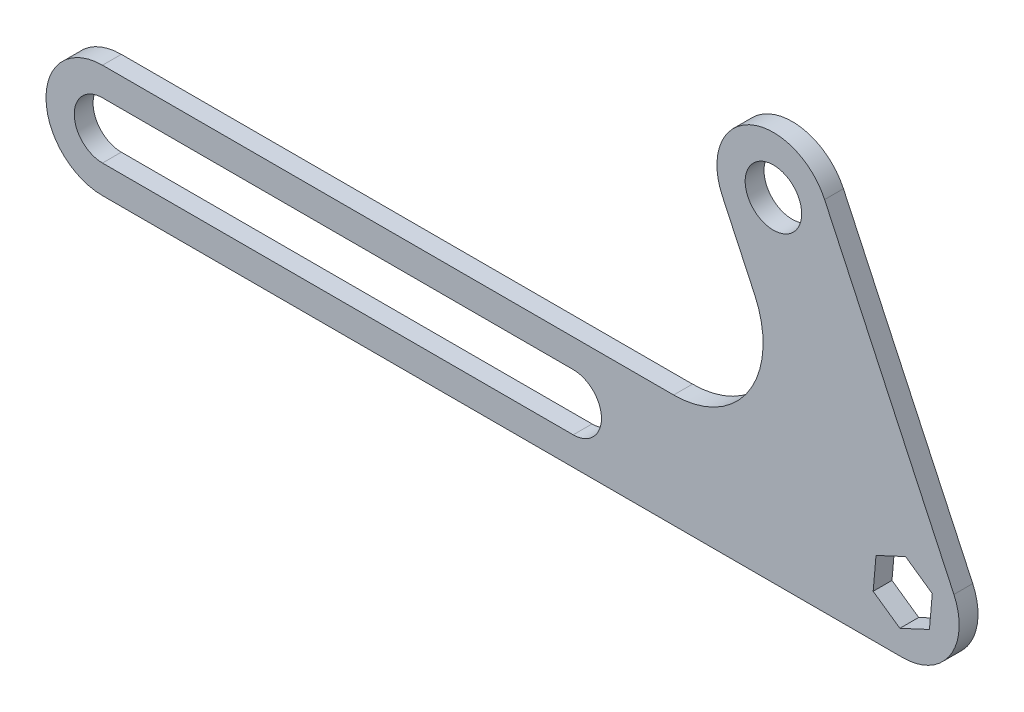
from build123d import *

# Parameters (mm, degrees)
SKETCH2_R           = 6
BOSS_EXTRUDE1_DEPTH = 4


with BuildPart() as part:
    # Sketch2 → Boss-Extrude1 (new body)
    with BuildSketch(Plane.XY):
        with BuildLine():
            Line((-31.440404937, 39.029746973), (-38.345880458, 53.838587016))
            ThreePointArc((-38.345880458, 53.838587016), (-32.541606154, 69.785699602), (-16.594493569, 63.981425298))
            Line((-16.594493569, 63.981425298), (10.875693444, 5.071419141))
            ThreePointArc((10.875693444, 5.071419141), (10.12069735, -6.4475953), (0, -12))
            Line((0, -12), (-170, -12))
            ThreePointArc((-170, -12), (-182, 0), (-170, 12))
            Line((-170, 12), (-48.660252891, 12))
            ThreePointArc((-48.660252891, 12), (-32.63581542, 20.791307441), (-31.440404937, 39.029746973))
        make_face()
        with Locations((-27.470187013, 58.910006157)):
            Circle(SKETCH2_R, mode=Mode.SUBTRACT)
        Polygon((5.675251839, -3.973854119), (6.279084538, 2.927985206), (0.603832698, 6.901839325), (-5.675251839, 3.973854119), (-6.279084538, -2.927985206), (-0.603832698, -6.901839325), align=None, mode=Mode.SUBTRACT)
        with BuildLine():
            ThreePointArc((-70, -6), (-64, 0), (-70, 6))
            Line((-70, 6), (-170, 6))
            ThreePointArc((-170, 6), (-176, 0), (-170, -6))
            Line((-170, -6), (-70, -6))
        make_face(mode=Mode.SUBTRACT)
    extrude(amount=BOSS_EXTRUDE1_DEPTH)


solid = part.part
